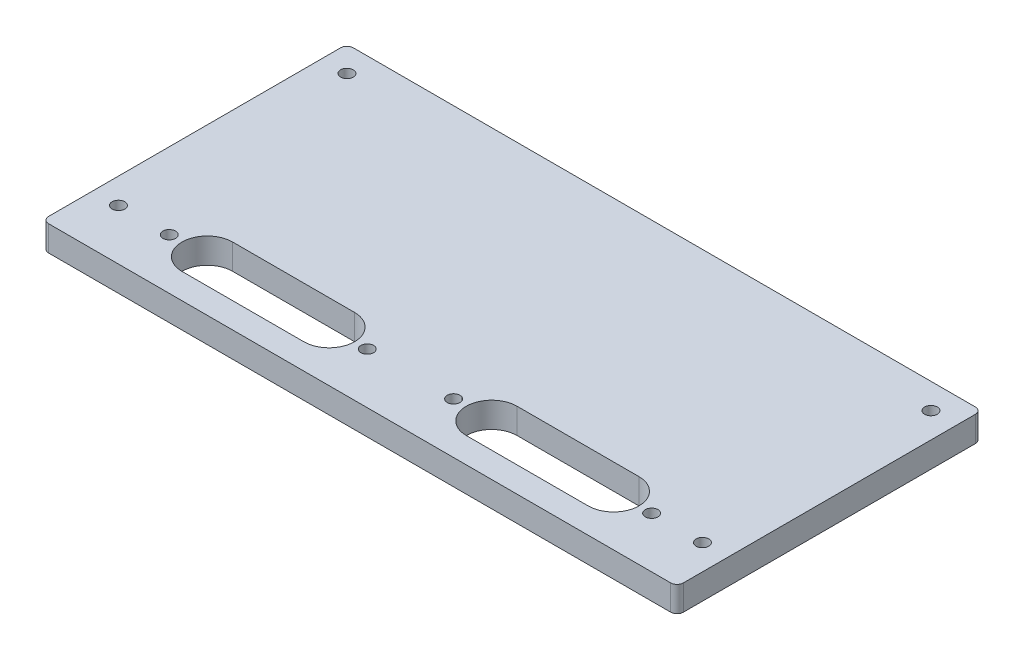
from build123d import *

# Parameters (mm, degrees)
SKETCH1_W           = 317.5
SKETCH1_H           = 152.4
SKETCH1_R           = 3.175
BOSS_EXTRUDE1_DEPTH = 12.7
FILLET1_R           = 3.175


with BuildPart() as part:
    # Sketch1 → Boss-Extrude1 (new body)
    with BuildSketch(Plane(origin=(0, 0, 0), x_dir=(1, 0, 0), z_dir=(0, 1, 0))):
        with Locations((158.75, 76.2)):
            Rectangle(SKETCH1_W, SKETCH1_H)
        with Locations(Location((12.7, 25.4, 0), (0, 0, 270))):
            Circle(SKETCH1_R, mode=Mode.SUBTRACT)
        with Locations(Location((12.7, 139.7, 0), (0, 0, 270))):
            Circle(SKETCH1_R, mode=Mode.SUBTRACT)
        with Locations(Location((304.8, 139.7, 0), (0, 0, 270))):
            Circle(SKETCH1_R, mode=Mode.SUBTRACT)
        with Locations(Location((304.8, 25.4, 0), (0, 0, 270))):
            Circle(SKETCH1_R, mode=Mode.SUBTRACT)
        with Locations(Location((38.1, 25.4, 0), (0, 0, 270))):
            Circle(SKETCH1_R, mode=Mode.SUBTRACT)
        with Locations(Location((137.16, 25.4, 0), (0, 0, 270))):
            Circle(SKETCH1_R, mode=Mode.SUBTRACT)
        with Locations(Location((180.34, 25.4, 0), (0, 0, 90))):
            Circle(SKETCH1_R, mode=Mode.SUBTRACT)
        with Locations(Location((279.4, 25.4, 0), (0, 0, 90))):
            Circle(SKETCH1_R, mode=Mode.SUBTRACT)
        with BuildLine():
            Line((57.15, 38.1), (118.11, 38.1))
            ThreePointArc((118.11, 38.1), (130.81, 25.4), (118.11, 12.7))
            Line((118.11, 12.7), (57.15, 12.7))
            ThreePointArc((57.15, 12.7), (44.45, 25.4), (57.15, 38.1))
        make_face(mode=Mode.SUBTRACT)
        with BuildLine():
            Line((260.35, 38.1), (199.39, 38.1))
            ThreePointArc((199.39, 38.1), (186.69, 25.4), (199.39, 12.7))
            Line((199.39, 12.7), (260.35, 12.7))
            ThreePointArc((260.35, 12.7), (273.05, 25.4), (260.35, 38.1))
        make_face(mode=Mode.SUBTRACT)
    extrude(amount=BOSS_EXTRUDE1_DEPTH)

    # Fillet1
    fillet1_edges = [part.edges().sort_by_distance(p)[0] for p in [
        (0, 6.35, -152.4),
        (317.5, 6.35, -152.4),
        (317.5, 6.35, 0),
        (0, 6.35, 0),
    ]]
    fillet(fillet1_edges, radius=FILLET1_R)


solid = part.part
